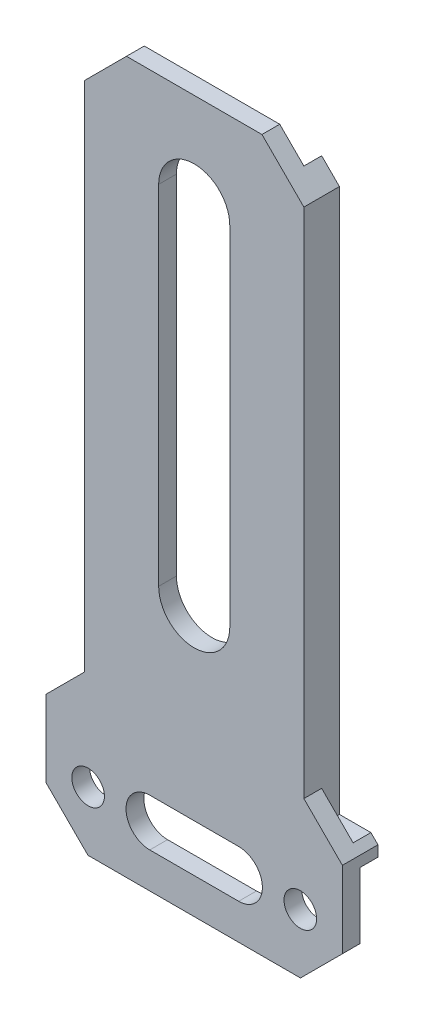
from build123d import *

# Parameters (mm, degrees)
SKETCH1_R           = 2.75
BOSS_EXTRUDE1_DEPTH = 3
BOSS_EXTRUDE2_DEPTH = 3


with BuildPart() as part:
    # Sketch1 → Boss-Extrude1 (new body)
    with BuildSketch(Plane.XY):
        Polygon((7.071067812, 0), (42.928932188, 0), (50, 7.071067812), (50, 20), (43.5, 26.5), (43.5, 112.928932188), (36.428932188, 120), (13.571067812, 120), (6.5, 112.928932188), (6.5, 26.5), (0, 20), (0, 7.071067812), align=None)
        with Locations((7.1, 10)):
            Circle(SKETCH1_R, mode=Mode.SUBTRACT)
        with Locations(Location((42.9, 10, 0), (0, 0, 180))):
            Circle(SKETCH1_R, mode=Mode.SUBTRACT)
        with BuildLine():
            Line((19, 45.27), (19, 104))
            ThreePointArc((19, 104), (25, 110), (31, 104))
            Line((31, 104), (31, 45.27))
            ThreePointArc((31, 45.27), (25, 39.27), (19, 45.27))
        make_face(mode=Mode.SUBTRACT)
        with BuildLine():
            Line((17.5, 14), (32.5, 14))
            ThreePointArc((32.5, 14), (36.5, 10), (32.5, 6))
            Line((32.5, 6), (17.5, 6))
            ThreePointArc((17.5, 6), (13.5, 10), (17.5, 14))
        make_face(mode=Mode.SUBTRACT)
    extrude(amount=BOSS_EXTRUDE1_DEPTH)

    # Sketch2 → Boss-Extrude2 (add)
    with BuildSketch(Plane(origin=(0, 0, 0), x_dir=(-1, 0, 0), z_dir=(0, 0, -1))):
        Polygon((-50, 18.19), (0, 18.19), (0, 20), (-1.19, 21.19), (-6.5, 21.19), (-6.5, 112.928932188), (-9.5, 115.928932188), (-9.5, 21.19), (-40.5, 21.19), (-40.5, 115.928932188), (-43.5, 112.928932188), (-43.5, 21.19), (-48.81, 21.19), (-50, 20), align=None)
    extrude(amount=BOSS_EXTRUDE2_DEPTH)


solid = part.part
